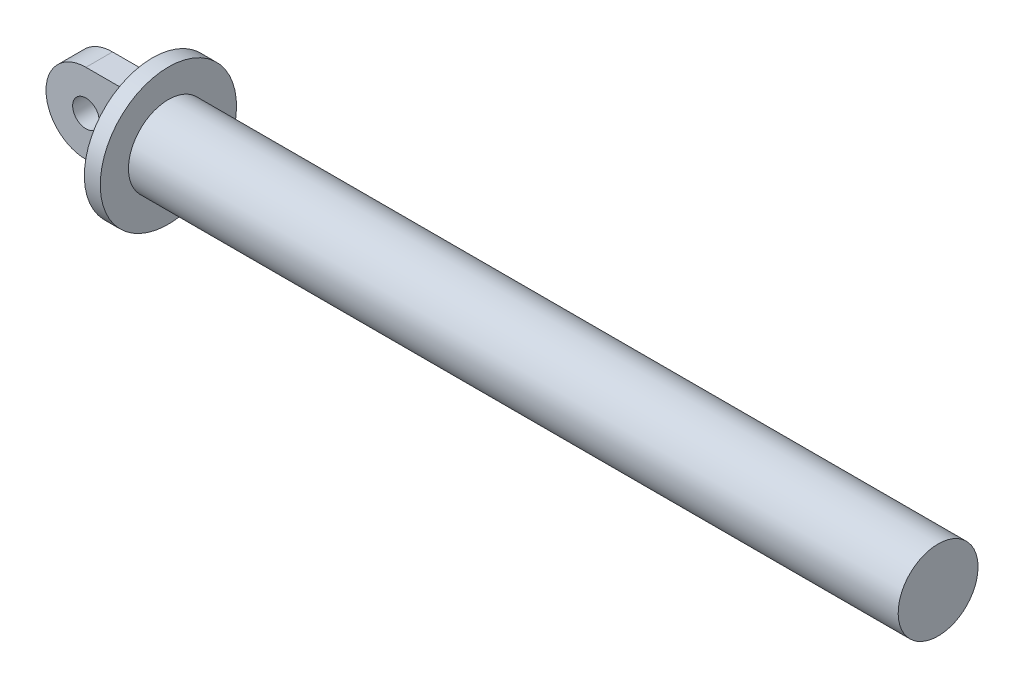
from build123d import *

# Parameters (mm, degrees)
SKETCH2_R           = 5
BOSS_EXTRUDE1_DEPTH = 5


with BuildPart() as part:
    # Sketch2 → Boss-Extrude1 (new, symmetric)
    with BuildSketch(Plane.XY):
        with BuildLine():
            Line((-25.982341551, 28.402024397), (-5.982341551, 28.402024397))
            Line((-5.982341551, 28.402024397), (-5.982341551, -1.597975603))
            Line((-5.982341551, -1.597975603), (-25.982341551, -1.597975603))
            ThreePointArc((-25.982341551, -1.597975603), (-40.982341551, 13.402024397), (-25.982341551, 28.402024397))
        make_face()
        with Locations((-25.982341551, 13.402024397)):
            Circle(SKETCH2_R, mode=Mode.SUBTRACT)
    extrude(amount=BOSS_EXTRUDE1_DEPTH, both=True)

    # Sketch8 → Revolve1 (revolve)
    with BuildSketch(Plane.XY):
        Polygon((-5.982341551, 28.402024397), (-5.982341551, 39), (0, 39), (0, 28.402024397), (289.215653405, 28.402024397), (289.215653405, 13.402024397), (-5.982341551, 13.402024397), align=None)
    revolve(axis=Axis((289.215653405, 13.402024397, 0), (-1, 0, 0)))


solid = part.part
